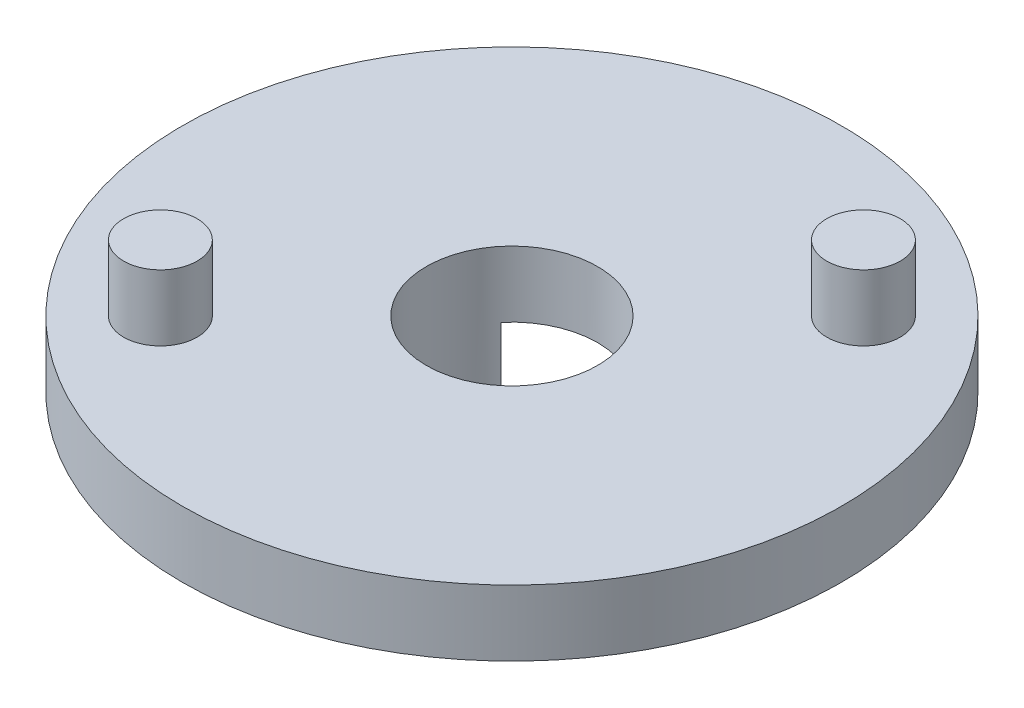
from build123d import *

# Parameters (mm, degrees)
BOSS_EXTRUDE1_DEPTH = 1.75
SKETCH2_R           = 7.5
BOSS_EXTRUDE2_DEPTH = 1.5
SKETCH3_R           = 1.95
CUT_EXTRUDE1_DEPTH  = 12.093353866
SKETCH4_R           = 0.8365
BOSS_EXTRUDE3_DEPTH = 1.5


with BuildPart() as part:
    # Sketch1 → Boss-Extrude1 (new body)
    with BuildSketch(Plane(origin=(0, 0, 0), x_dir=(1, 0, 0), z_dir=(0, 1, 0))):
        with BuildLine():
            Line((-2.616772822, 1.25), (2.616772822, 1.25))
            ThreePointArc((2.616772822, 1.25), (2.9, 0), (2.616772822, -1.25))
            Line((2.616772822, -1.25), (-2.616772822, -1.25))
            ThreePointArc((-2.616772822, -1.25), (-2.9, 0), (-2.616772822, 1.25))
        make_face()
    extrude(amount=BOSS_EXTRUDE1_DEPTH)

    # Sketch2 → Boss-Extrude2 (add)
    with BuildSketch(Plane(origin=(0, 1.75, 0), x_dir=(1, 0, 0), z_dir=(0, 1, 0))):
        with Locations(Location((0, 0, 0), (0, 0, 270))):
            Circle(SKETCH2_R)
    extrude(amount=BOSS_EXTRUDE2_DEPTH)

    # Sketch3 → Cut-Extrude1 (cut, through all)
    with BuildSketch(Plane(origin=(0, 3.25, 0), x_dir=(1, 0, 0), z_dir=(0, 1, 0))):
        with Locations(Location((0, 0, 0), (0, 0, 270))):
            Circle(SKETCH3_R)
    extrude(amount=-CUT_EXTRUDE1_DEPTH, mode=Mode.SUBTRACT)

    # Sketch4 → Boss-Extrude3 (add)
    with BuildSketch(Plane(origin=(0, 3.25, 0), x_dir=(1, 0, 0), z_dir=(0, 1, 0))):
        with Locations(Location((4, 4, 0), (0, 0, 270))):
            Circle(SKETCH4_R)
        with Locations(Location((-4, -4, 0), (0, 0, 270))):
            Circle(SKETCH4_R)
    extrude(amount=BOSS_EXTRUDE3_DEPTH)


solid = part.part
